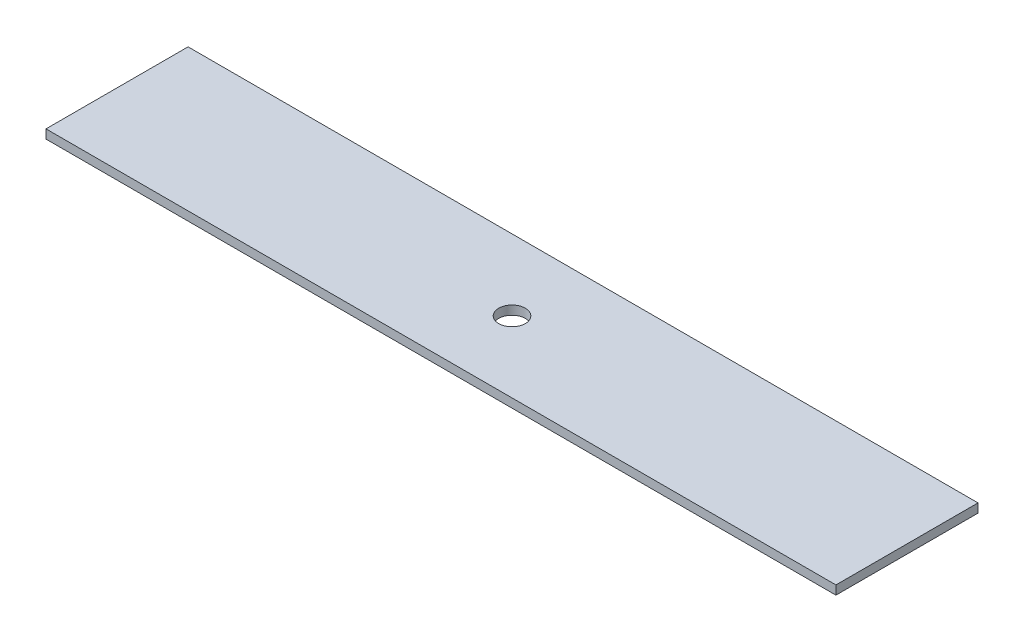
from build123d import *

# Parameters (mm, degrees)
SKETCH1_W           = 282.448
SKETCH1_H           = 50.8
BOSS_EXTRUDE1_DEPTH = 3.175
CUT_EXTRUDE1_REACH  = 145.525
SKETCH2_R           = 4.7625


with BuildPart() as part:
    # Sketch1 → Boss-Extrude1 (new body)
    with BuildSketch(Plane(origin=(0, 0, 0), x_dir=(1, 0, 0), z_dir=(0, 1, 0))):
        Rectangle(SKETCH1_W, SKETCH1_H)
    extrude(amount=BOSS_EXTRUDE1_DEPTH)

    # Sketch2 → Cut-Extrude1 (cut, up to next)
    with BuildSketch(Plane(origin=(0, 3.175, 0), x_dir=(1, 0, 0), z_dir=(0, 1, 0)), mode=Mode.PRIVATE) as cut_extrude1_sk1:
        with Locations(Location((0, 0, 0), (0, 0, 270))):
            Circle(SKETCH2_R)
    cut_extrude1_tool1 = extrude(cut_extrude1_sk1.sketch, amount=-CUT_EXTRUDE1_REACH, mode=Mode.PRIVATE) & part.part
    add(cut_extrude1_tool1.solids().sort_by_distance((0, 3.175, 0))[0], mode=Mode.SUBTRACT)


solid = part.part
